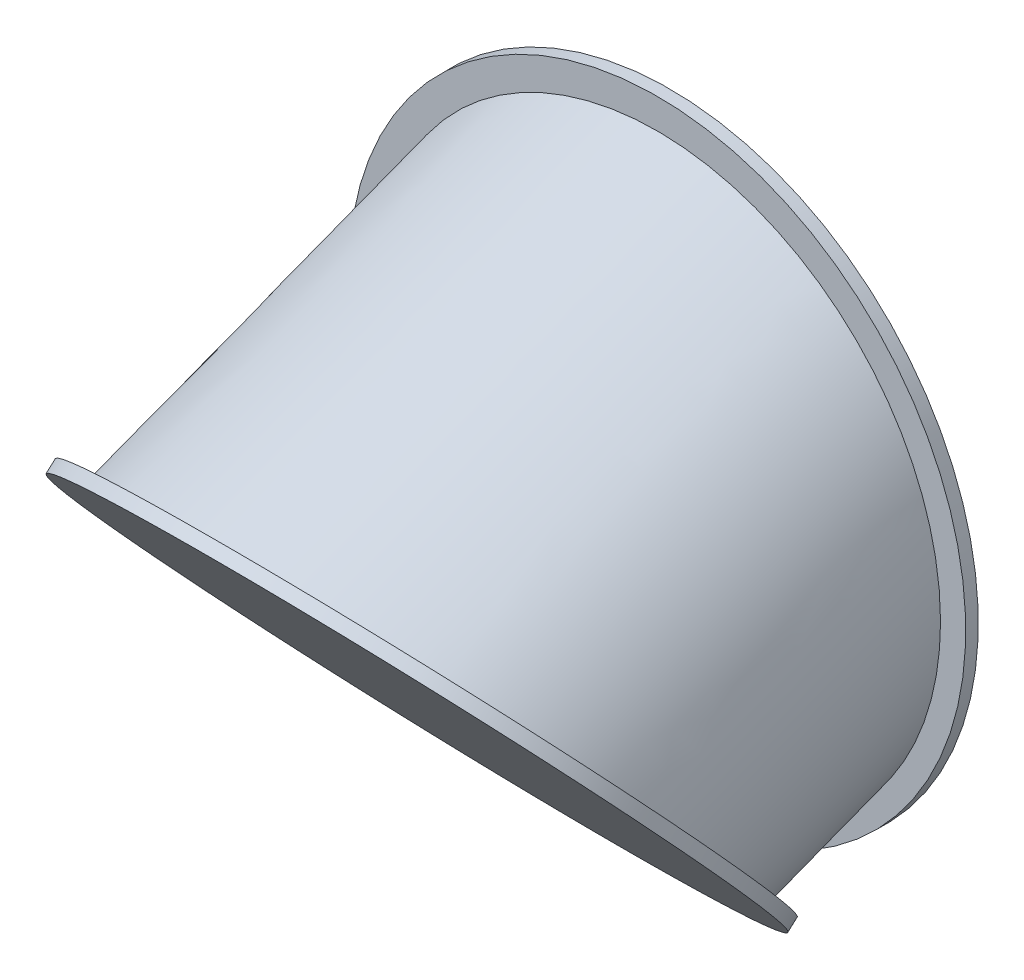
from build123d import *

# Parameters (mm, degrees)
SKETCH1_R           = 11.25
SKETCH11_R          = 12.25
BOSS_EXTRUDE2_DEPTH = 0.5
SKETCH9_R           = 12.25
BOSS_EXTRUDE3_DEPTH = 0.5


with BuildPart() as part:
    # Sweep1: sweep along a path in Sketch3
    with BuildLine(Plane(origin=(0, 0, 0), x_dir=(0, 0, -1), z_dir=(1, 0, 0))) as sweep1_path:
        Line((0, 0), (-23.339510662, -8.959198739))
    # Sketch1 → Sweep1 (sweep)
    with BuildSketch(Plane.XY):
        Circle(SKETCH1_R)
    sweep(path=sweep1_path.line)

    # SurfaceCut3
    split(bisect_by=Plane(origin=(0, -6.716036525, 7.458914215), x_dir=(1, 0, 0), z_dir=(0, -0.6691306063588593, 0.7431448254773932)), keep=Keep.BOTTOM)

    # Sketch11 → Boss-Extrude2 (add)
    with BuildSketch(Plane(origin=(0, -6.716036525, 7.458914215), x_dir=(1, 0, 0), z_dir=(0, -0.6691306063588595, 0.7431448254773932))):
        with Locations(Location((0, 3.852827618, 0), (0, 0, 270))):
            Circle(SKETCH11_R)
    extrude(amount=-BOSS_EXTRUDE2_DEPTH)

    # Sketch9 → Boss-Extrude3 (add)
    with BuildSketch(Plane(origin=(0, 0, 0), x_dir=(-1, 0, 0), z_dir=(0, 0, -1))):
        Circle(SKETCH9_R)
    extrude(amount=-BOSS_EXTRUDE3_DEPTH)


solid = part.part
